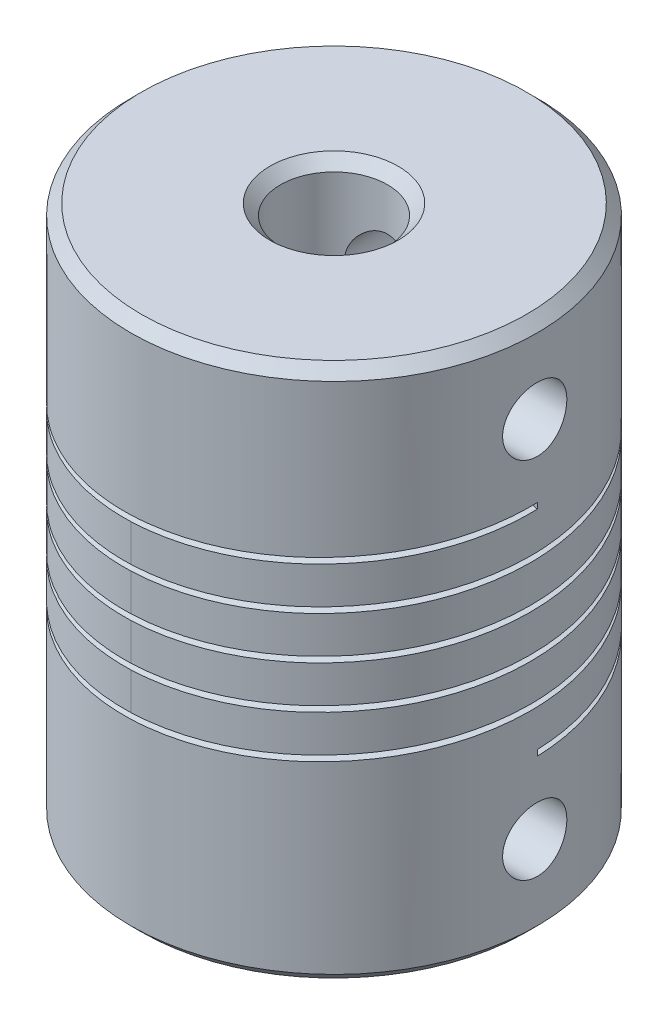
from build123d import *

# Parameters (mm, degrees)
SKETCH1_R                 = 9.5
BOSS_EXTRUDE1_DEPTH       = 12.5
SKETCH2_R                 = 2.5
CUT_EXTRUDE1_DEPTH        = 12.5
SKETCH3_R                 = 4
CUT_EXTRUDE2_DEPTH        = 12.5
CHAMFER1_SIZE             = 0.5
CUT_SWEEP1_PITCH          = 2
CUT_SWEEP1_HEIGHT         = 10
CUT_SWEEP1_RADIUS         = 9.5
CUT_SWEEP1_START_ANGLE    = 90
CUT_EXTRUDE3_REACH        = 20.351
CUT_EXTRUDE3_END_RADIUS   = 9.5
SKETCH6_R                 = 1.5
CIRPATTERN1_COUNT         = 2
CIRPATTERN1_ANGLE         = 90
MIRROR1_COPY_1_REACH      = 20.351
MIRROR1_COPY_1_END_RADIUS = 9.5
MIRROR1_COPY_1_SKETCH_R   = 1.5


with BuildPart() as part:
    # Sketch1 → Boss-Extrude1 (new, symmetric)
    with BuildSketch(Plane(origin=(0, 0, 0), x_dir=(1, 0, 0), z_dir=(0, 1, 0))):
        with Locations(Location((0, 0, 0), (0, 0, 270))):
            Circle(SKETCH1_R)
    extrude(amount=BOSS_EXTRUDE1_DEPTH, both=True)

    # Sketch2 → Cut-Extrude1 (cut)
    with BuildSketch(Plane(origin=(0, 12.5, 0), x_dir=(1, 0, 0), z_dir=(0, 1, 0))):
        with Locations(Location((0, 0, 0), (0, 0, 270))):
            Circle(SKETCH2_R)
    extrude(amount=-CUT_EXTRUDE1_DEPTH, mode=Mode.SUBTRACT)

    # Sketch3 → Cut-Extrude2 (cut)
    with BuildSketch(Plane.XZ.offset(12.5)):
        with Locations(Location((0, 0, 0), (0, 0, 270))):
            Circle(SKETCH3_R)
    extrude(amount=-CUT_EXTRUDE2_DEPTH, mode=Mode.SUBTRACT)

    # Chamfer1
    chamfer1_edges = [part.edges().sort_by_distance(p)[0] for p in [
        (0, -12.5, 4),
        (0, -12.5, -9.5),
        (0, 12.5, -9.5),
        (0, 12.5, -2.5),
    ]]
    chamfer(chamfer1_edges, length=CHAMFER1_SIZE)

    # Cut-Sweep1: sweep along a helix
    with BuildLine() as cut_sweep1_path:
        add(Helix(CUT_SWEEP1_PITCH, CUT_SWEEP1_HEIGHT, CUT_SWEEP1_RADIUS, center=(0, -5, 0), direction=(0, 1, 0), mode=Mode.PRIVATE).rotate(Axis((0, -5, 0), (0, 1, 0)), CUT_SWEEP1_START_ANGLE))
    # Sketch5 → Cut-Sweep1 (sweep, cut)
    with BuildSketch(Plane.XY):
        Polygon((10, 5.267949192), (9, 5), (10, 4.732050808), align=None)
    sweep(path=cut_sweep1_path.line, is_frenet=True, mode=Mode.SUBTRACT)

    # Cut-Extrude3: up to this cylinder (the profile starts inside it)
    cut_extrude3_end = Plane(origin=(0, 8.5, 0), z_dir=(0, -1, 0)) * Cylinder(CUT_EXTRUDE3_END_RADIUS, 60.702, mode=Mode.PRIVATE)
    # Sketch6 → Cut-Extrude3 (cut, up to the surface)
    with BuildSketch(Plane.XY, mode=Mode.PRIVATE) as cut_extrude3_sk1:
        with Locations((0, 8.5)):
            Circle(SKETCH6_R)
    cut_extrude3_tool1 = extrude(cut_extrude3_sk1.sketch, amount=-CUT_EXTRUDE3_REACH, mode=Mode.PRIVATE) & cut_extrude3_end
    cut_extrude3 = cut_extrude3_tool1.solids().sort_by_distance((0, 8.5, 0))[0]
    add(cut_extrude3, mode=Mode.SUBTRACT)

    # CirPattern1: Cut-Extrude3 ×2 about axis
    cirpattern1_axis = Axis((0, 12.5, 0), (0, -1, 0))
    for i in range(1, CIRPATTERN1_COUNT):
        add(cut_extrude3.rotate(cirpattern1_axis, i * CIRPATTERN1_ANGLE / (CIRPATTERN1_COUNT - 1)), mode=Mode.SUBTRACT)

    # Mirror1: Cut-Extrude3 across plane
    add(cut_extrude3.mirror(Plane.ZX), mode=Mode.SUBTRACT)

    # Mirror1 copy 1: up to this cylinder (the profile starts inside it)
    mirror1_copy_1_end = Plane(origin=(0, 8.5, 0), z_dir=(0, -1, 0)) * Cylinder(MIRROR1_COPY_1_END_RADIUS, 60.702, mode=Mode.PRIVATE)
    # Mirror1 copy 1 sketch → Mirror1 copy 1 (cut, up to the surface)
    with BuildSketch(Plane.ZY, mode=Mode.PRIVATE) as mirror1_copy_1_sk1:
        with Locations((0, -8.5)):
            Circle(MIRROR1_COPY_1_SKETCH_R)
    mirror1_copy_1_tool1 = extrude(mirror1_copy_1_sk1.sketch, amount=-MIRROR1_COPY_1_REACH, mode=Mode.PRIVATE) & mirror1_copy_1_end
    add(mirror1_copy_1_tool1.solids().sort_by_distance((0, 8.5, 0))[0], mode=Mode.SUBTRACT)


solid = part.part
